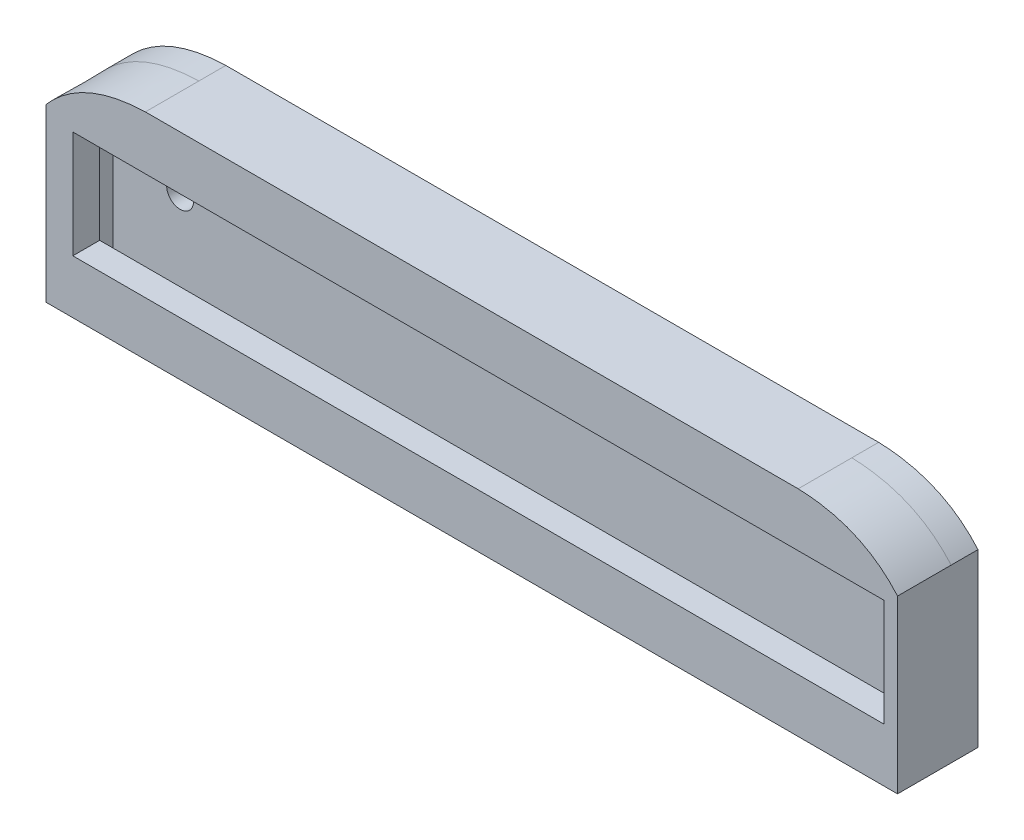
from build123d import *

# Parameters (mm, degrees)
BOSS_EXTRUDE1_DEPTH = 2
BOSS_EXTRUDE2_DEPTH = 2
SKETCH4_W           = 60.5
SKETCH4_H           = 8
BOSS_EXTRUDE3_DEPTH = 2
SKETCH5_R           = 1
CUT_EXTRUDE1_DEPTH  = 1
CUT_EXTRUDE2_DEPTH  = 1


with BuildPart() as part:
    # Sketch1 → Boss-Extrude1 (new body)
    with BuildSketch(Plane.XY):
        with BuildLine():
            Line((23.840057871, 8), (-24.840057871, 8))
            add(Edge.make_bspline(
                [(-24.840057871, 8), (-29.579374102, 7.859454073), (-32.25, 4.777235297)],
                knots=[0, 0, 0, 1, 1, 1], degree=2))
            Line((-32.25, 4.777235297), (-32.25, -8))
            Line((-32.25, -8), (31.25, -8))
            Line((31.25, -8), (31.25, 4.777235297))
            add(Edge.make_bspline(
                [(23.840057871, 8), (28.579374102, 7.859454073), (31.25, 4.777235297)],
                knots=[0, 0, 0, 1, 1, 1], degree=2))
        make_face()
    extrude(amount=BOSS_EXTRUDE1_DEPTH)

    # Sketch2 → Boss-Extrude2 (add)
    with BuildSketch(Plane.XY.offset(2)):
        with BuildLine():
            Line((-32.25, -8), (31.25, -8))
            Line((31.25, -8), (31.250000012, 4.777235284))
            add(Edge.make_bspline(
                [(31.250000012, 4.777235284), (28.579374112, 7.859454073), (23.840057871, 8)],
                knots=[0, 0, 0, 1, 1, 1], degree=2))
            Line((23.840057871, 8), (-24.84005786, 8))
            add(Edge.make_bspline(
                [(-24.84005786, 8), (-29.579374099, 7.859454077), (-32.25, 4.777235297)],
                knots=[0, 0, 0, 1, 1, 1], degree=2))
            Line((-32.25, 4.777235297), (-32.25, -8))
        make_face()
        with BuildLine():
            Line((-31.25, -7), (30.25, -7))
            Line((30.25, -7), (30.250000006, 4.392275401))
            add(Edge.make_bspline(
                [(30.250000006, 4.392275401), (29.838936293, 4.827054032), (29.388289272, 5.208885934), (28.405623687, 5.863706962), (27.867648486, 6.137833076), (26.761664402, 6.561008933), (26.189843053, 6.714315907), (25.015344092, 6.925422761), (24.421635521, 6.981682834), (23.824977184, 7)],
                knots=[0, 0, 0, 0, 0.25, 0.25, 0.5, 0.5, 0.75, 0.75, 1, 1, 1, 1], degree=3))
            Line((23.824977184, 7), (-24.824977186, 7))
            add(Edge.make_bspline(
                [(-24.824977186, 7), (-25.421773324, 6.981678604), (-26.010765986, 6.925523135), (-27.169262236, 6.718722121), (-27.738796388, 6.568224766), (-28.574197272, 6.250843034), (-28.850434321, 6.12895654), (-29.381068271, 5.858126444), (-29.893359619, 5.559169961), (-30.368382987, 5.203067082), (-30.824570304, 4.818081166), (-31.043507271, 4.610681029), (-31.25, 4.392275407)],
                knots=[0, 0, 0, 0, 0.25, 0.25, 0.5, 0.5, 0.625, 0.625, 0.75, 0.875, 0.875, 1, 1, 1, 1], degree=3))
            Line((-31.25, 4.392275407), (-31.25, -7))
        make_face(mode=Mode.SUBTRACT)
    extrude(amount=BOSS_EXTRUDE2_DEPTH)

    # Sketch4 → Boss-Extrude3 (add)
    with BuildSketch(Plane.XY.offset(4)):
        with BuildLine():
            Line((-32.25, -8), (31.25, -8))
            Line((31.25, -8), (31.250000012, 4.777235284))
            add(Edge.make_bspline(
                [(31.250000012, 4.777235284), (28.579374112, 7.859454073), (23.840057871, 8)],
                knots=[0, 0, 0, 1, 1, 1], degree=2))
            Line((23.840057871, 8), (-24.84005786, 8))
            add(Edge.make_bspline(
                [(-24.84005786, 8), (-29.579374099, 7.859454077), (-32.25, 4.777235297)],
                knots=[0, 0, 0, 1, 1, 1], degree=2))
            Line((-32.25, 4.777235297), (-32.25, -8))
        make_face()
        Rectangle(SKETCH4_W, SKETCH4_H, mode=Mode.SUBTRACT)
    extrude(amount=BOSS_EXTRUDE3_DEPTH)

    # Sketch5 → Cut-Extrude1 (cut)
    with BuildSketch(Plane.XY.offset(2)):
        with Locations((-26.25, 0)):
            Circle(SKETCH5_R)
    extrude(amount=-CUT_EXTRUDE1_DEPTH, mode=Mode.SUBTRACT)

    # Sketch6 → Cut-Extrude2 (cut)
    with BuildSketch(Plane(origin=(0, 0, 0), x_dir=(-1, 0, 0), z_dir=(0, 0, -1))):
        with BuildLine():
            Line((24.840057871, 8), (31.25, 8))
            Line((31.25, 8), (32.25, 4.777235297))
            add(Edge.make_bspline(
                [(24.840057871, 8), (29.579374102, 7.859454073), (32.25, 4.777235297)],
                knots=[0, 0, 0, 1, 1, 1], degree=2))
        make_face()
    cut_extrude2 = extrude(amount=-CUT_EXTRUDE2_DEPTH, mode=Mode.SUBTRACT)

    # Mirror1: Cut-Extrude2 across plane
    add(cut_extrude2.mirror(Plane(origin=(0, 0, 0), x_dir=(0, 0, 1), z_dir=(1, 0, 0))), mode=Mode.SUBTRACT)


solid = part.part
